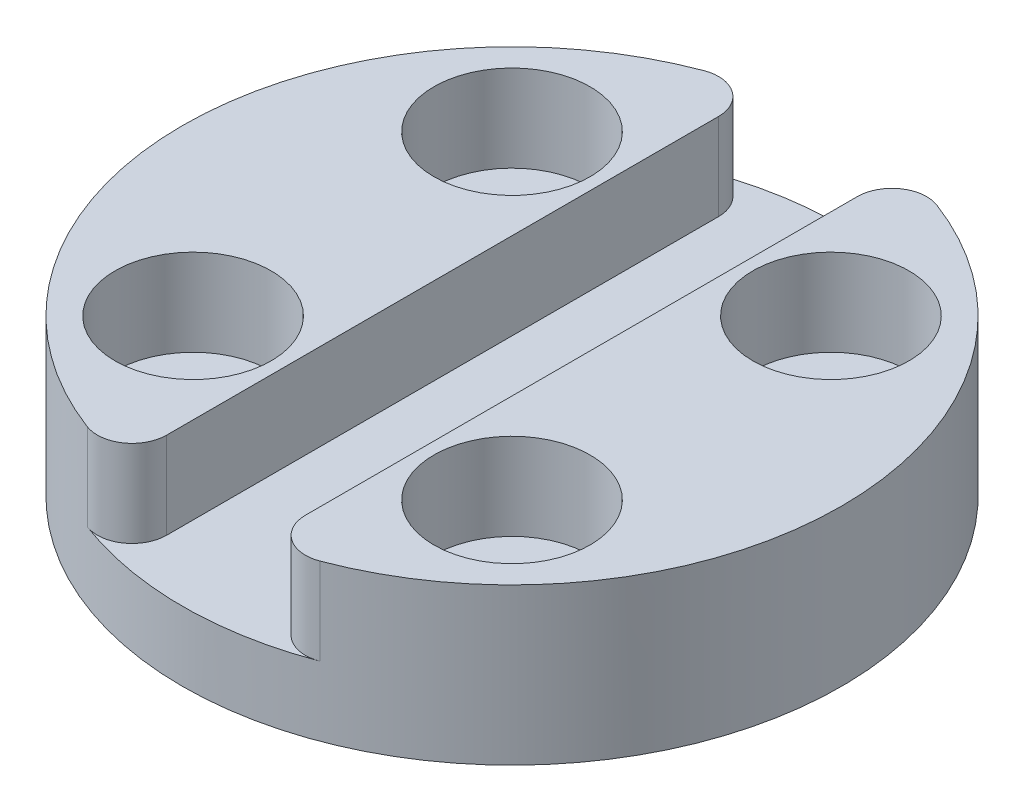
from build123d import *

# Parameters (mm, degrees)
SKETCH_1_R      = 9.5
SKETCH_1_R_2    = 1.25
EXTRUDE_1_DEPTH = 2
SKETCH_2_R      = 2.25
EXTRUDE_2_DEPTH = 2.5


with BuildPart() as part:
    # 草图1 → 凸台-拉伸1 (new body)
    with BuildSketch(Plane(origin=(0, 0, 0), x_dir=(1, 0, 0), z_dir=(0, 1, 0))):
        with Locations(Location((0, 0, 0), (0, 0, 270))):
            Circle(SKETCH_1_R)
        with Locations(Location((4.596194078, 4.596194078, 0), (0, 0, 270))):
            Circle(SKETCH_1_R_2, mode=Mode.SUBTRACT)
        with Locations(Location((4.596194078, -4.596194078, 0), (0, 0, 270))):
            Circle(SKETCH_1_R_2, mode=Mode.SUBTRACT)
        with Locations(Location((-4.596194078, -4.596194078, 0), (0, 0, 270))):
            Circle(SKETCH_1_R_2, mode=Mode.SUBTRACT)
        with Locations(Location((-4.596194078, 4.596194078, 0), (0, 0, 270))):
            Circle(SKETCH_1_R_2, mode=Mode.SUBTRACT)
    extrude(amount=EXTRUDE_1_DEPTH)

    # 草图2 → 凸台-拉伸2 (add)
    # profile 1 of 2: a face of its own
    with BuildSketch(Plane(origin=(0, 2, 0), x_dir=(1, 0, 0), z_dir=(0, 1, 0))):
        with BuildLine():
            Line((-2, 7.95298686), (-2, -7.95298686))
            ThreePointArc((-2, -7.95298686), (-2.431203541, -8.775465181), (-3.352941176, -8.888632373))
            ThreePointArc((-3.352941176, -8.888632373), (-9.5, 0), (-3.352941176, 8.888632373))
            ThreePointArc((-3.352941176, 8.888632373), (-2.431203541, 8.775465181), (-2, 7.95298686))
        make_face()
        with Locations(Location((-4.596194078, 4.596194078, 0), (0, 0, 270))):
            Circle(SKETCH_2_R, mode=Mode.SUBTRACT)
        with Locations(Location((-4.596194078, -4.596194078, 0), (0, 0, 270))):
            Circle(SKETCH_2_R, mode=Mode.SUBTRACT)
    # profile 2 of 2: a face of its own
    with BuildSketch(Plane(origin=(0, 2, 0), x_dir=(1, 0, 0), z_dir=(0, 1, 0))):
        with BuildLine():
            Line((2, 7.95298686), (2, -7.95298686))
            ThreePointArc((2, -7.95298686), (2.431203541, -8.775465181), (3.352941176, -8.888632373))
            ThreePointArc((3.352941176, -8.888632373), (9.5, 0), (3.352941176, 8.888632373))
            ThreePointArc((3.352941176, 8.888632373), (2.431203541, 8.775465181), (2, 7.95298686))
        make_face()
        with Locations(Location((4.596194078, 4.596194078, 0), (0, 0, 270))):
            Circle(SKETCH_2_R, mode=Mode.SUBTRACT)
        with Locations(Location((4.596194078, -4.596194078, 0), (0, 0, 270))):
            Circle(SKETCH_2_R, mode=Mode.SUBTRACT)
    extrude(amount=EXTRUDE_2_DEPTH)


solid = part.part
